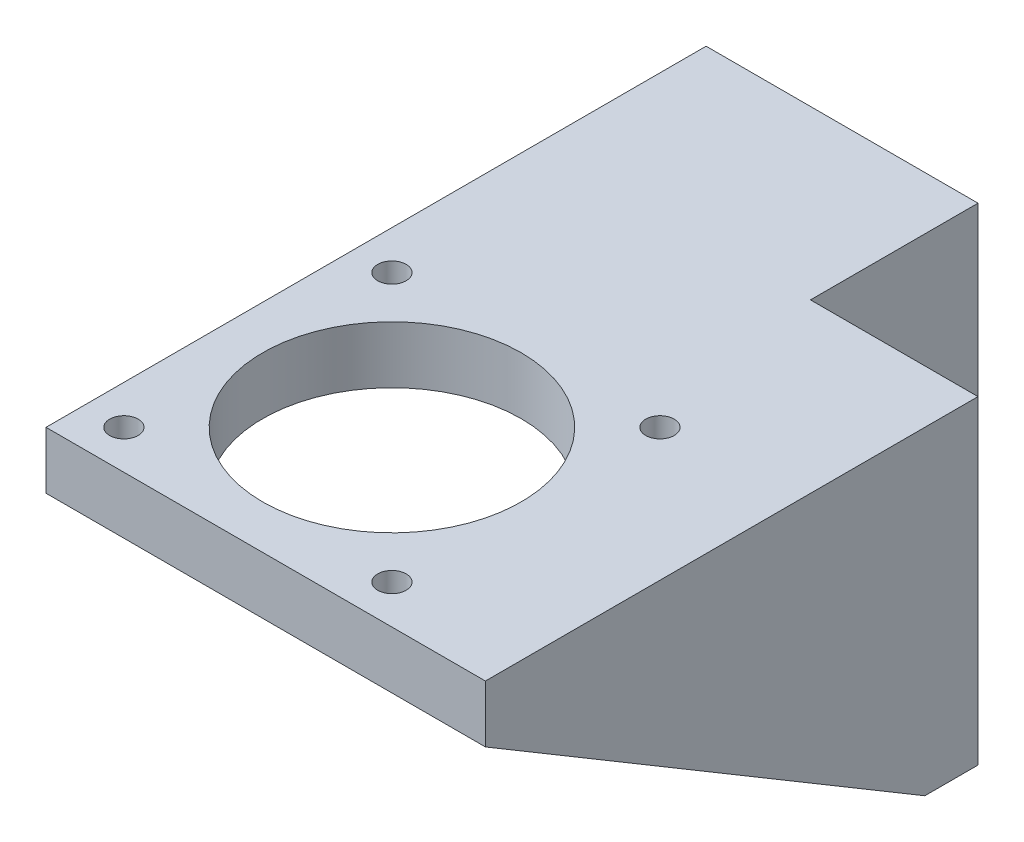
from build123d import *

# Parameters (mm, degrees)
SKETCH1_W            = 20
SKETCH1_H            = 6.35
SKETCH1_W_2          = 6.35
SKETCH1_H_2          = 20
BOSS_EXTRUDE1_DEPTH  = 38.1
SKETCH2_W            = 26.11
SKETCH2_H            = 26.35
BOSS_EXTRUDE2_DEPTH  = 6.81899017
BOSS_EXTRUDE3_DEPTH  = 2.54
BOSS_EXTRUDE4_DEPTH  = 2.54
BOSS_EXTRUDE5_DEPTH  = 2.54
M4_CLEARANCE_HOLE1_D = 4.5
M4_CLEARANCE_HOLE2_D = 4.5


with BuildPart() as part:
    # Sketch1 → Boss-Extrude1 (new body)
    with BuildSketch(Plane(origin=(0, 0, 0), x_dir=(1, 0, 0), z_dir=(0, 1, 0))):
        with Locations((10, -3.175)):
            Rectangle(SKETCH1_W, SKETCH1_H)
        with Locations((-3.175, -3.175)):
            Rectangle(SKETCH1_W_2, SKETCH1_H)
        with Locations((-3.175, 10)):
            Rectangle(SKETCH1_W_2, SKETCH1_H_2)
    extrude(amount=BOSS_EXTRUDE1_DEPTH)

    # Sketch2 → Boss-Extrude2 (add)
    with BuildSketch(Plane(origin=(0, 38.1, 0), x_dir=(1, 0, 0), z_dir=(0, 1, 0))):
        with BuildLine():
            Line((-32.46, -58.81), (8.84, -58.81))
            Line((8.84, -58.81), (5.392081528, -55.362081528))
            ThreePointArc((5.392081528, -55.362081528), (3.539438165, -55.730595205), (2.49, -54.16))
            Line((2.49, -54.16), (-26.11, -54.16))
            ThreePointArc((-26.11, -54.16), (-27.159438165, -55.730595205), (-29.012081528, -55.362081528))
            Line((-29.012081528, -55.362081528), (-32.46, -58.81))
        make_face()
        with BuildLine():
            Line((5.392081528, -55.362081528), (8.84, -58.81))
            Line((8.84, -58.81), (8.84, -17.51))
            Line((8.84, -17.51), (5.392081528, -20.957918472))
            ThreePointArc((5.392081528, -20.957918472), (5.760595205, -21.509438165), (5.89, -22.16))
            ThreePointArc((5.89, -22.16), (5.392081528, -23.362081528), (4.19, -23.86))
            Line((4.19, -23.86), (4.19, -52.46))
            ThreePointArc((4.19, -52.46), (5.392081528, -52.957918472), (5.89, -54.16))
            ThreePointArc((5.89, -54.16), (5.760595205, -54.810561835), (5.392081528, -55.362081528))
        make_face()
        Polygon((20, -58.81), (20, -6.35), (-6.35, -6.35), (-32.46, -6.35), (-32.46, -17.51), (8.84, -17.51), (8.84, -58.81), align=None)
        with Locations((-19.405, 6.825)):
            Rectangle(SKETCH2_W, SKETCH2_H)
        with BuildLine():
            Line((8.84, -17.51), (-32.46, -17.51))
            Line((-32.46, -17.51), (-29.012081528, -20.957918472))
            ThreePointArc((-29.012081528, -20.957918472), (-27.159438165, -20.589404795), (-26.11, -22.16))
            Line((-26.11, -22.16), (2.49, -22.16))
            ThreePointArc((2.49, -22.16), (3.539438165, -20.589404795), (5.392081528, -20.957918472))
            Line((5.392081528, -20.957918472), (8.84, -17.51))
        make_face()
        with BuildLine():
            Line((-29.012081528, -20.957918472), (-32.46, -17.51))
            Line((-32.46, -17.51), (-32.46, -58.81))
            Line((-32.46, -58.81), (-29.012081528, -55.362081528))
            ThreePointArc((-29.012081528, -55.362081528), (-29.380595205, -53.509438165), (-27.81, -52.46))
            Line((-27.81, -52.46), (-27.81, -23.86))
            ThreePointArc((-27.81, -23.86), (-29.380595205, -22.810561835), (-29.012081528, -20.957918472))
        make_face()
        with BuildLine():
            ThreePointArc((-26.607918472, -23.362081528), (-27.159438165, -23.730595205), (-27.81, -23.86))
            Line((-27.81, -23.86), (-27.81, -52.46))
            ThreePointArc((-27.81, -52.46), (-27.159438165, -52.589404795), (-26.607918472, -52.957918472))
            Line((-26.607918472, -52.957918472), (-22.7220672, -49.0720672))
            ThreePointArc((-22.7220672, -49.0720672), (-27.241993428, -38.16), (-22.7220672, -27.2479328))
            Line((-22.7220672, -27.2479328), (-26.607918472, -23.362081528))
        make_face()
        with BuildLine():
            Line((2.49, -22.16), (-26.11, -22.16))
            ThreePointArc((-26.11, -22.16), (-26.239404795, -22.810561835), (-26.607918472, -23.362081528))
            Line((-26.607918472, -23.362081528), (-22.7220672, -27.2479328))
            ThreePointArc((-22.7220672, -27.2479328), (-11.81, -22.728006572), (-0.8979328, -27.2479328))
            Line((-0.8979328, -27.2479328), (2.987918472, -23.362081528))
            ThreePointArc((2.987918472, -23.362081528), (2.619404795, -22.810561835), (2.49, -22.16))
        make_face()
        with BuildLine():
            Line((-0.8979328, -49.0720672), (2.987918472, -52.957918472))
            ThreePointArc((2.987918472, -52.957918472), (3.539438165, -52.589404795), (4.19, -52.46))
            Line((4.19, -52.46), (4.19, -23.86))
            ThreePointArc((4.19, -23.86), (3.539438165, -23.730595205), (2.987918472, -23.362081528))
            Line((2.987918472, -23.362081528), (-0.8979328, -27.2479328))
            ThreePointArc((-0.8979328, -27.2479328), (2.447302874, -32.254431787), (3.621993428, -38.16))
            ThreePointArc((3.621993428, -38.16), (2.447302874, -44.065568213), (-0.8979328, -49.0720672))
        make_face()
        with BuildLine():
            Line((-26.11, -54.16), (2.49, -54.16))
            ThreePointArc((2.49, -54.16), (2.619404795, -53.509438165), (2.987918472, -52.957918472))
            Line((2.987918472, -52.957918472), (-0.8979328, -49.0720672))
            ThreePointArc((-0.8979328, -49.0720672), (-11.81, -53.591993428), (-22.7220672, -49.0720672))
            Line((-22.7220672, -49.0720672), (-26.607918472, -52.957918472))
            ThreePointArc((-26.607918472, -52.957918472), (-26.239404795, -53.509438165), (-26.11, -54.16))
        make_face()
    extrude(amount=-BOSS_EXTRUDE2_DEPTH)

    # Sketch3 → Boss-Extrude3 (add)
    with BuildSketch(Plane(origin=(20, 0, 0), x_dir=(0, 0, -1), z_dir=(1, 0, 0))):
        Polygon((-58.81, 31.28100983), (-6.35, 0), (-6.35, 31.28100983), align=None)
    extrude(amount=-BOSS_EXTRUDE3_DEPTH)

    # Sketch4 → Boss-Extrude4 (add)
    with BuildSketch(Plane(origin=(0, 0, -20), x_dir=(-1, 0, 0), z_dir=(0, 0, -1))):
        Polygon((6.35, 0), (32.46, 31.28100983), (6.35, 31.28100983), align=None)
    extrude(amount=-BOSS_EXTRUDE4_DEPTH)

    # Sketch5 → Boss-Extrude5 (add)
    with BuildSketch(Plane.XY.offset(6.35)):
        Polygon((-6.35, -0.46899017), (-32.46, 31.28100983), (-6.35, 31.28100983), align=None)
    extrude(amount=-BOSS_EXTRUDE5_DEPTH)

    # M4 Clearance Hole1 (through all)
    with Locations(Plane.ZY.offset(6.35)):
        with Locations((-10, 23.460757372), (-10, 7.820252457)):
            Hole(M4_CLEARANCE_HOLE1_D / 2)

    # M4 Clearance Hole2 (through all)
    with Locations(Plane.XY.offset(6.35)):
        with Locations((10, 7.820252457), (10, 23.460757372)):
            Hole(M4_CLEARANCE_HOLE2_D / 2)


solid = part.part
